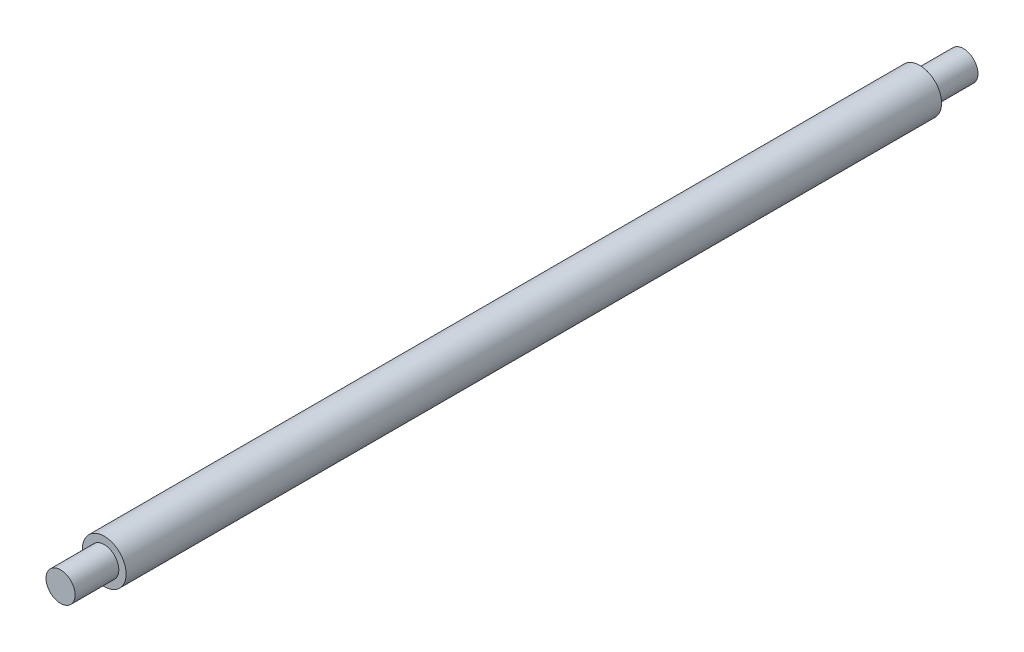
from build123d import *

# Parameters (mm, degrees)
SKETCH1_R           = 9.525
BOSS_EXTRUDE1_DEPTH = 355.6
SKETCH2_R           = 6.35
BOSS_EXTRUDE2_DEPTH = 19.05
BOSS_EXTRUDE3_START = 19.05
SKETCH3_R           = 6.35
BOSS_EXTRUDE3_DEPTH = 19.05


with BuildPart() as part:
    # Sketch1 → Boss-Extrude1 (new body)
    with BuildSketch(Plane.XY):
        Circle(SKETCH1_R)
    extrude(amount=BOSS_EXTRUDE1_DEPTH)

    # Sketch2 → Boss-Extrude2 (add)
    with BuildSketch(Plane.XY.offset(355.6)):
        with Locations(Location((0, 0, 0), (0, 0, 180))):
            Circle(SKETCH2_R)
    extrude(amount=BOSS_EXTRUDE2_DEPTH)

    # Sketch3 → Boss-Extrude3 (add)
    with BuildSketch(Plane(origin=(0, 0, 0), x_dir=(-1, 0, 0), z_dir=(0, 0, -1)).offset(BOSS_EXTRUDE3_START)):
        Circle(SKETCH3_R)
    extrude(amount=-BOSS_EXTRUDE3_DEPTH)


solid = part.part
